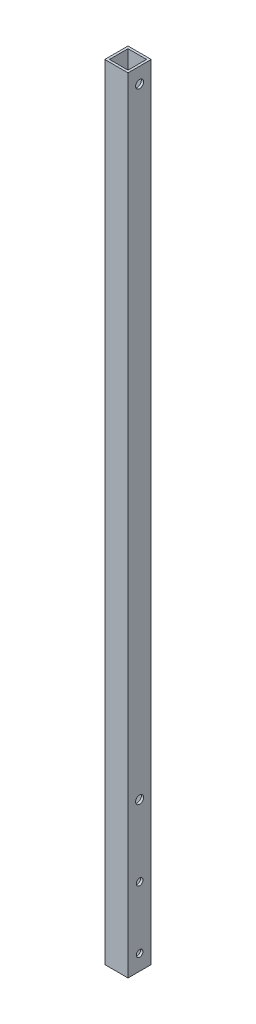
from build123d import *

# Parameters (mm, degrees)
SKETCH_1_W          = 15
SKETCH_1_H          = 15
SKETCH_1_W_2        = 12
SKETCH_1_H_2        = 12
EXTRUDE_1_DEPTH     = 506
CUT_EXTRUDE_1_REACH = 508.444
SKETCH_2_R          = 2.6
SKETCH_2_R_2        = 2.15


with BuildPart() as part:
    # ｽｹｯﾁ1 → 押し出し-薄板1 (new body)
    with BuildSketch(Plane(origin=(0, 0, 0), x_dir=(1, 0, 0), z_dir=(0, 1, 0))):
        with Locations((7.5, 7.5)):
            Rectangle(SKETCH_1_W, SKETCH_1_H)
        with Locations((7.5, 7.5)):
            Rectangle(SKETCH_1_W_2, SKETCH_1_H_2, mode=Mode.SUBTRACT)
    extrude(amount=EXTRUDE_1_DEPTH)

    # ｶｯﾄ - 押し出し1: up to this face of the body (flat: up to its plane)
    cut_extrude_1_end = Plane(part.part.faces().sort_by_distance((0, 253, -7.5))[0])
    # ｽｹｯﾁ2 → ｶｯﾄ - 押し出し1 (cut, up to the picked face)
    with BuildSketch(Plane(origin=(15, 0, 0), x_dir=(0, 0, -1), z_dir=(1, 0, 0)), mode=Mode.PRIVATE) as cut_extrude_1_sk1:
        with Locations((7.5, 496)):
            Circle(SKETCH_2_R)
    cut_extrude_1_tool1 = split(extrude(cut_extrude_1_sk1.sketch, amount=-CUT_EXTRUDE_1_REACH, mode=Mode.PRIVATE), bisect_by=cut_extrude_1_end, keep=Keep.BOTH, mode=Mode.PRIVATE)
    # ｽｹｯﾁ2 → ｶｯﾄ - 押し出し1 (cut, up to the picked face)
    with BuildSketch(Plane(origin=(15, 0, 0), x_dir=(0, 0, -1), z_dir=(1, 0, 0)), mode=Mode.PRIVATE) as cut_extrude_1_sk2:
        with Locations((7.5, 10)):
            Circle(SKETCH_2_R_2)
    cut_extrude_1_tool2 = split(extrude(cut_extrude_1_sk2.sketch, amount=-CUT_EXTRUDE_1_REACH, mode=Mode.PRIVATE), bisect_by=cut_extrude_1_end, keep=Keep.BOTH, mode=Mode.PRIVATE)
    # ｽｹｯﾁ2 → ｶｯﾄ - 押し出し1 (cut, up to the picked face)
    with BuildSketch(Plane(origin=(15, 0, 0), x_dir=(0, 0, -1), z_dir=(1, 0, 0)), mode=Mode.PRIVATE) as cut_extrude_1_sk3:
        with Locations((7.5, 50)):
            Circle(SKETCH_2_R_2)
    cut_extrude_1_tool3 = split(extrude(cut_extrude_1_sk3.sketch, amount=-CUT_EXTRUDE_1_REACH, mode=Mode.PRIVATE), bisect_by=cut_extrude_1_end, keep=Keep.BOTH, mode=Mode.PRIVATE)
    # ｽｹｯﾁ2 → ｶｯﾄ - 押し出し1 (cut, up to the picked face)
    with BuildSketch(Plane(origin=(15, 0, 0), x_dir=(0, 0, -1), z_dir=(1, 0, 0)), mode=Mode.PRIVATE) as cut_extrude_1_sk4:
        with Locations((7.5, 96)):
            Circle(SKETCH_2_R)
    cut_extrude_1_tool4 = split(extrude(cut_extrude_1_sk4.sketch, amount=-CUT_EXTRUDE_1_REACH, mode=Mode.PRIVATE), bisect_by=cut_extrude_1_end, keep=Keep.BOTH, mode=Mode.PRIVATE)
    add(cut_extrude_1_tool1.solids().sort_by(Axis((15, 496, -7.5), (-1, 0, 0)))[0], mode=Mode.SUBTRACT)
    add(cut_extrude_1_tool2.solids().sort_by(Axis((15, 10, -7.5), (-1, 0, 0)))[0], mode=Mode.SUBTRACT)
    add(cut_extrude_1_tool3.solids().sort_by(Axis((15, 50, -7.5), (-1, 0, 0)))[0], mode=Mode.SUBTRACT)
    add(cut_extrude_1_tool4.solids().sort_by(Axis((15, 96, -7.5), (-1, 0, 0)))[0], mode=Mode.SUBTRACT)


solid = part.part
